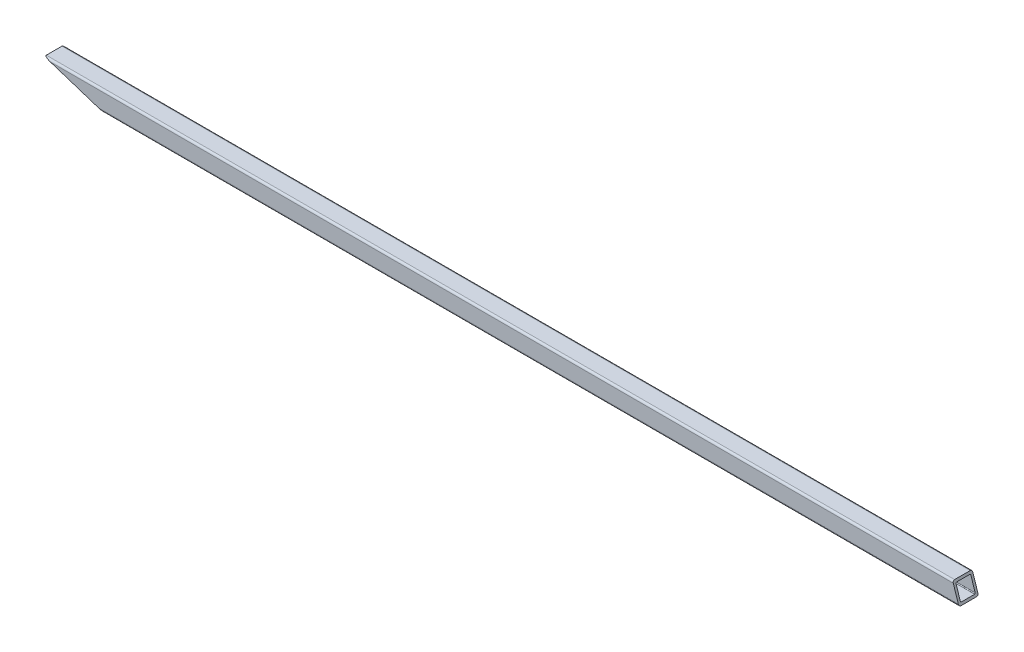
from build123d import *

# Parameters (mm, degrees)
SKETCH3_W           = 25.4
SKETCH3_H           = 25.4
SKETCH3_W_2         = 19.304
SKETCH3_H_2         = 19.304
BOSS_EXTRUDE1_DEPTH = 1190.03
FILLET1_R           = 2.5
FILLET2_R           = 1
CUT_EXTRUDE1_DEPTH  = 1191.368787771


with BuildPart() as part:
    # Sketch3 → Boss-Extrude1 (new body)
    with BuildSketch(Plane(origin=(0, 0, 0), x_dir=(0, 0, -1), z_dir=(1, 0, 0))):
        Rectangle(SKETCH3_W, SKETCH3_H)
        Rectangle(SKETCH3_W_2, SKETCH3_H_2, mode=Mode.SUBTRACT)
    extrude(amount=-BOSS_EXTRUDE1_DEPTH)

    # Fillet1
    fillet1_edges = [part.edges().sort_by_distance(p)[0] for p in [
        (-595.015, -12.7, -12.7),
        (-595.015, -12.7, 12.7),
        (-595.015, 12.7, 12.7),
        (-595.015, 12.7, -12.7),
    ]]
    fillet(fillet1_edges, radius=FILLET1_R)

    # Fillet2
    fillet2_edges = [part.edges().sort_by_distance(p)[0] for p in [
        (-595.015, 9.652, -9.652),
        (-595.015, -9.652, -9.652),
        (-595.015, -9.652, 9.652),
        (-595.015, 9.652, 9.652),
    ]]
    fillet(fillet2_edges, radius=FILLET2_R)

    # Sketch5 → Cut-Extrude1 (cut, through all)
    with BuildSketch(Plane(origin=(0, 0, -12.7), x_dir=(-1, 0, 0), z_dir=(0, 0, -1))):
        Polygon((1190.03, 12.7), (1111.856838156, -12.7), (1190.03, -12.7), align=None)
        Polygon((0, 12.7), (8.252960284, 12.7), (0, -12.7), align=None)
    extrude(amount=-CUT_EXTRUDE1_DEPTH, mode=Mode.SUBTRACT)


solid = part.part
